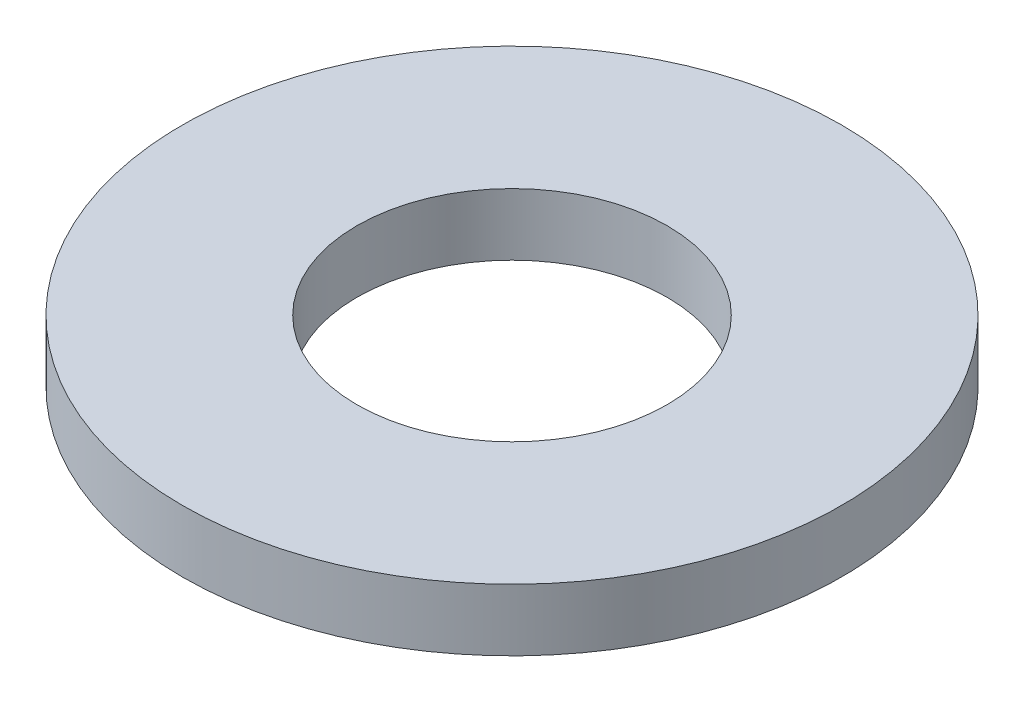
from build123d import *

# Parameters (mm, degrees)
SKETCH1_R           = 3.4
SKETCH1_R_2         = 1.6
BOSS_EXTRUDE1_DEPTH = 0.64


with BuildPart() as part:
    # Sketch1 → Boss-Extrude1 (new body)
    with BuildSketch(Plane(origin=(0, 0, 0), x_dir=(1, 0, 0), z_dir=(0, 1, 0))):
        with Locations(Location((0, 0, 0), (0, 0, 90))):
            Circle(SKETCH1_R)
        with Locations(Location((0, 0, 0), (0, 0, 90))):
            Circle(SKETCH1_R_2, mode=Mode.SUBTRACT)
    extrude(amount=BOSS_EXTRUDE1_DEPTH)


solid = part.part
